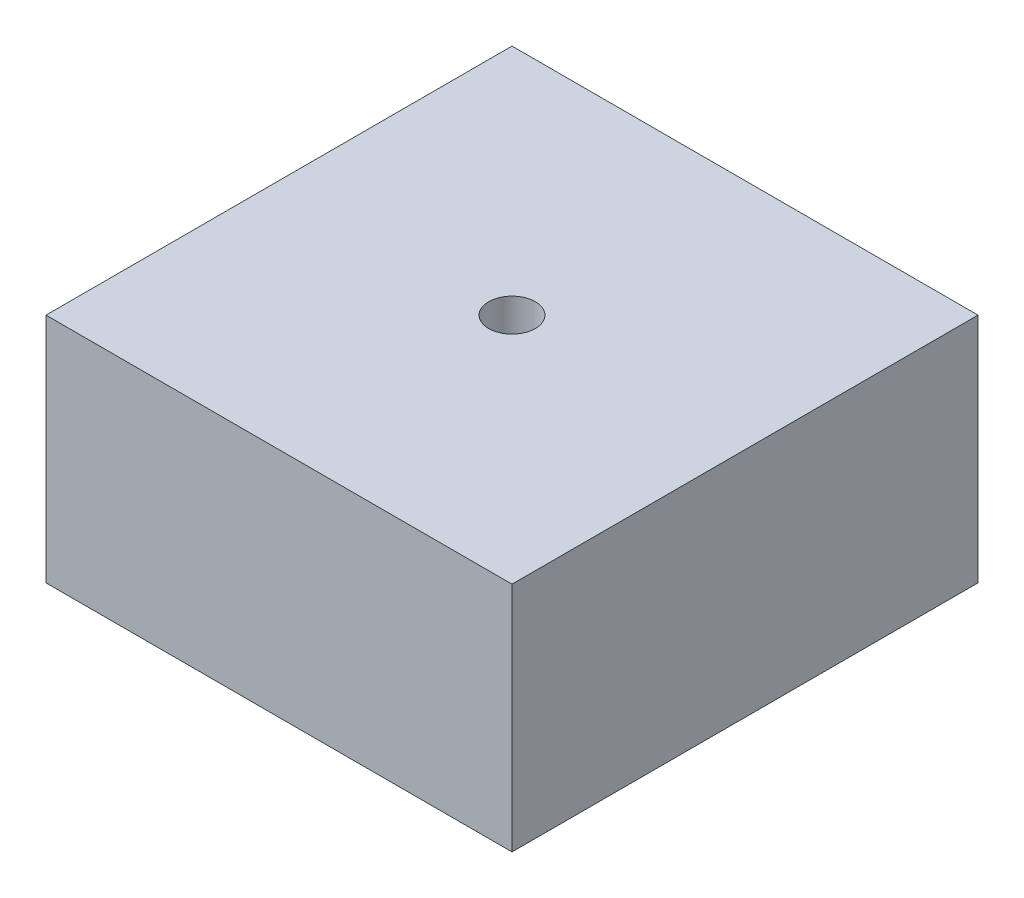
from build123d import *

# Parameters (mm, degrees)
SKETCH1_W           = 100
SKETCH1_H           = 100
BOSS_EXTRUDE1_DEPTH = 49.7625
SKETCH2_R           = 5
CUT_EXTRUDE1_DEPTH  = 87.465637141


with BuildPart() as part:
    # Sketch1 → Boss-Extrude1 (new body)
    with BuildSketch(Plane(origin=(0, 0, 0), x_dir=(1, 0, 0), z_dir=(0, 1, 0))):
        Rectangle(SKETCH1_W, SKETCH1_H)
    extrude(amount=BOSS_EXTRUDE1_DEPTH)

    # Sketch2 → Cut-Extrude1 (cut, through all)
    with BuildSketch(Plane(origin=(0, 49.7625, 0), x_dir=(-1, 0, 0), z_dir=(0, 1, 0))):
        with Locations(Location((0, 0, 0), (0, 0, 90))):
            Circle(SKETCH2_R)
    extrude(amount=-CUT_EXTRUDE1_DEPTH, mode=Mode.SUBTRACT)


solid = part.part
